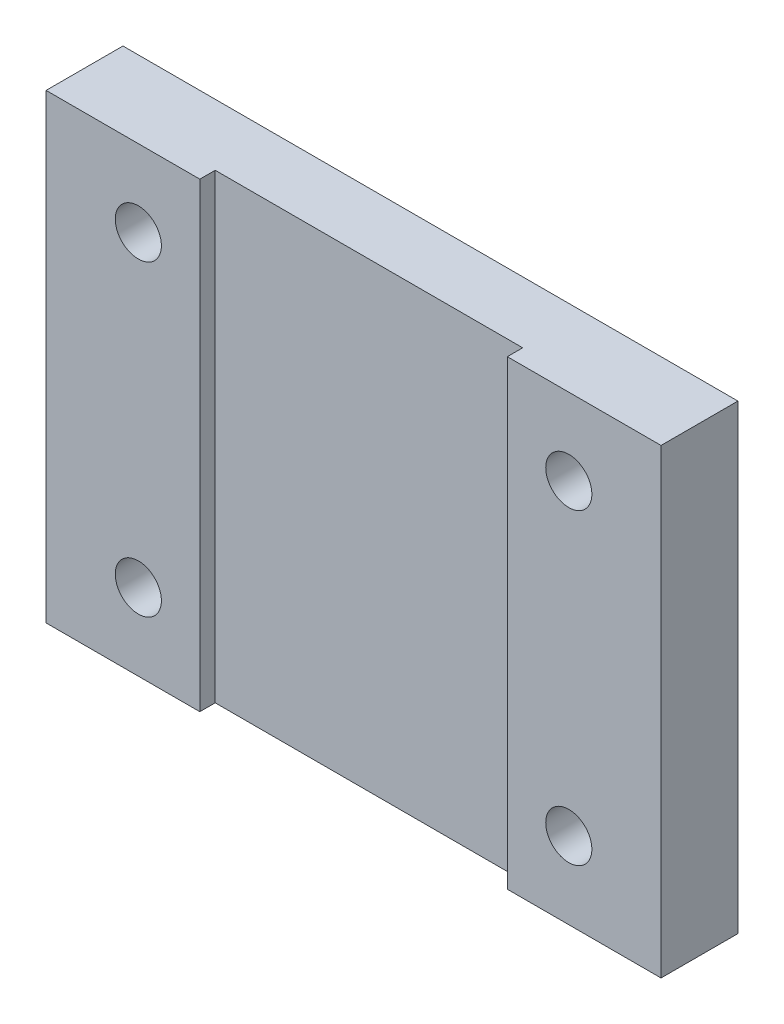
from build123d import *

# Parameters (mm, degrees)
SKETCH_1_W          = 40
SKETCH_1_H          = 30
EXTRUDE_1_DEPTH     = 5
SKETCH_2_R          = 1.5
CUT_EXTRUDE_1_DEPTH = 10
SKETCH_3_W          = 20
SKETCH_3_H          = 30
CUT_EXTRUDE_2_DEPTH = 1


with BuildPart() as part:
    # 草图1 → 凸台-拉伸1 (new body)
    with BuildSketch(Plane.XY):
        Rectangle(SKETCH_1_W, SKETCH_1_H)
    extrude(amount=EXTRUDE_1_DEPTH)

    # 草图2 → 切除-拉伸1 (cut)
    with BuildSketch(Plane(origin=(0, 0, 0), x_dir=(-1, 0, 0), z_dir=(0, 0, -1))):
        with Locations((14, 10)):
            Circle(SKETCH_2_R)
        with Locations((-14, 10)):
            Circle(SKETCH_2_R)
        with Locations((-14, -10)):
            Circle(SKETCH_2_R)
        with Locations((14, -10)):
            Circle(SKETCH_2_R)
    extrude(amount=-CUT_EXTRUDE_1_DEPTH, mode=Mode.SUBTRACT)

    # 草图3 → 切除-拉伸2 (cut)
    with BuildSketch(Plane.XY.offset(5)):
        Rectangle(SKETCH_3_W, SKETCH_3_H)
    extrude(amount=-CUT_EXTRUDE_2_DEPTH, mode=Mode.SUBTRACT)


solid = part.part
